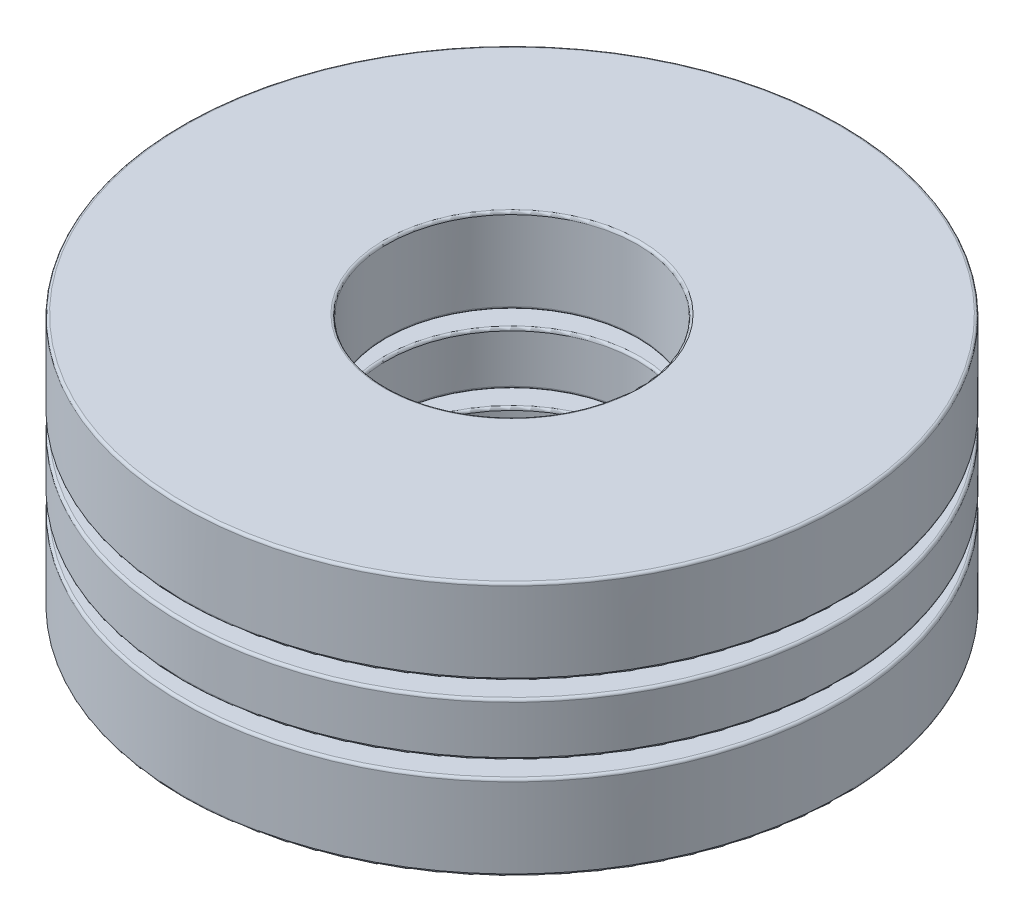
from build123d import *

# Parameters (mm, degrees)
SKETCH1_W         = 3.93065
SKETCH1_H         = 1.021291666
CIRPATTERN1_COUNT = 3
CIRPATTERN1_ANGLE = 240
CIRPATTERN2_COUNT = 3
SKETCH4_W         = 3.93065
SKETCH4_H         = 1.634066667
FILLET1_R         = 0.049022
FILLET2_R         = 0.049022
FILLET3_R         = 0.049022


with BuildPart() as part:
    # Sketch1 → Revolve1 (revolve)
    with BuildSketch(Plane(origin=(0, 0, 0), x_dir=(0, 0, -1), z_dir=(1, 0, 0)), mode=Mode.PRIVATE) as revolve1_sk:
        with Locations((-4.384675, 0)):
            Rectangle(SKETCH1_W, SKETCH1_H)
    revolve(revolve1_sk.sketch.rotate(Axis((0, -2.4511, 0), (0, 1, 0)), 180), axis=Axis((0, -2.4511, 0), (0, 1, 0)))

    # Sketch3 → Cut-Revolve1 (revolve, cut)
    with BuildSketch(Plane(origin=(0, 0, 0), x_dir=(0, 0, -1), z_dir=(1, 0, 0))):
        with BuildLine():
            Line((-4.384675, 0.817033333), (-4.384675, -0.817033333))
            ThreePointArc((-4.384675, -0.817033333), (-5.201708333, 0), (-4.384675, 0.817033333))
        make_face()
    cut_revolve1 = revolve(axis=Axis((0, 0.817033333, 4.384675), (0, -1, 0)), mode=Mode.SUBTRACT)

    # CirPattern2: Cut-Revolve1 ×3 about axis
    cirpattern2_axis = Axis((0, 0, 0), (0, 1, 0))
    for i in range(1, CIRPATTERN2_COUNT):
        add(cut_revolve1.rotate(cirpattern2_axis, i * 360 / CIRPATTERN2_COUNT), mode=Mode.SUBTRACT)

    # Fillet2
    fillet2_edges = [part.edges().sort_by_distance(p)[0] for p in [
        (0, 0.510645833, 6.35),
        (0, 0.510645833, 2.41935),
        (0, -0.510645833, 2.41935),
        (0, -0.510645833, 6.35),
    ]]
    fillet(fillet2_edges, radius=FILLET2_R)


with BuildPart() as body_2:
    # Sketch2 → Revolve2 (revolve)
    with BuildSketch(Plane(origin=(0, 0, 0), x_dir=(0, 0, -1), z_dir=(1, 0, 0))):
        with BuildLine():
            Line((-4.384675, 0.817033333), (-4.384675, -0.817033333))
            ThreePointArc((-4.384675, -0.817033333), (-5.201708333, 0), (-4.384675, 0.817033333))
        make_face()
    revolve(axis=Axis((0, 0.817033333, 4.384675), (0, -1, 0)))


with BuildPart() as cirpattern1_1:
    # CirPattern1: pattern copy
    add(body_2.part.rotate(Axis((0, 2.4511, 0), (0, -1, 0)), 1 * CIRPATTERN1_ANGLE / (CIRPATTERN1_COUNT - 1)))


with BuildPart() as cirpattern1_2:
    # CirPattern1: pattern copy
    add(body_2.part.rotate(Axis((0, 2.4511, 0), (0, -1, 0)), 2 * CIRPATTERN1_ANGLE / (CIRPATTERN1_COUNT - 1)))


with BuildPart() as body_5:
    # Sketch4 → Revolve3 (revolve)
    with BuildSketch(Plane(origin=(0, 0, 0), x_dir=(0, 0, -1), z_dir=(1, 0, 0)), mode=Mode.PRIVATE) as revolve3_sk:
        with Locations((-4.384675, 1.634066667)):
            Rectangle(SKETCH4_W, SKETCH4_H)
        with Locations((-4.384675, -1.634066667)):
            Rectangle(SKETCH4_W, SKETCH4_H)
    revolve(revolve3_sk.sketch.rotate(Axis((0, -2.4511, 0), (0, 1, 0)), 180), axis=Axis((0, -2.4511, 0), (0, 1, 0)))

    # Fillet1
    fillet1_edges = [body_5.edges().sort_by_distance(p)[0] for p in [
        (0, 0.817033333, 6.35),
        (0, 0.817033333, 2.41935),
        (0, 2.4511, 2.41935),
        (0, 2.4511, 6.35),
    ]]
    fillet(fillet1_edges, radius=FILLET1_R)

    # Fillet3
    fillet3_edges = [body_5.edges().sort_by_distance(p)[0] for p in [
        (0, -2.4511, 6.35),
        (0, -2.4511, 2.41935),
        (0, -0.817033333, 2.41935),
        (0, -0.817033333, 6.35),
    ]]
    fillet(fillet3_edges, radius=FILLET3_R)


solid = Compound([part.part, body_2.part, cirpattern1_1.part, cirpattern1_2.part, body_5.part])
